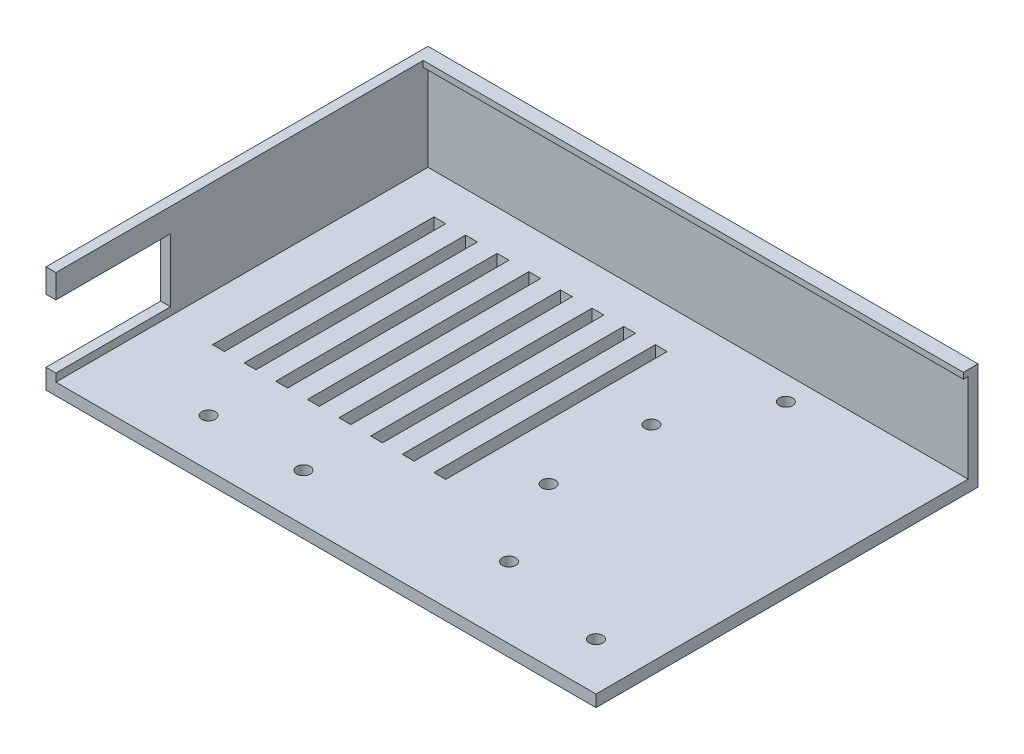
from build123d import *

# Parameters (mm, degrees)
SKETCH1_W                     = 278.2
SKETCH1_H                     = 193.2
SHELL_BLOCK_DEPTH             = 27
SKETCH2_W                     = 273.2
SKETCH2_H                     = 185.8
FRONT_OPENING_DEPTH           = 1.5
SKETCH3_W                     = 273.2
SKETCH3_H                     = 188.2
DISPLAY_POCKET_DEPTH          = 22.5
SKETCH4_W                     = 3
SKETCH4_H                     = 56
VENT_SLOTS_DEPTH              = 4
SKETCH5_W                     = 58
SKETCH5_H                     = 16
CABLE_EXIT_X_SHORT_SIDE_DEPTH = 140.1
SKETCH6_R                     = 1.7
BOLT_HOLES_DEPTH              = 4
KEEP_ONE_HALF_X_DEPTH         = 172.491603293
KEEP_ONE_HALF_X_DEPTH_BACK    = 172.491603293
SKETCH7_W                     = 200
SKETCH7_H                     = 400
KEEP_ONE_QUARTER_Z_DEPTH      = 172.491603293
KEEP_ONE_QUARTER_Z_DEPTH_BACK = 172.491603293
SKETCH8_W                     = 400
SKETCH8_H                     = 200


with BuildPart() as part:
    # Sketch1 → Shell Block (new body)
    with BuildSketch(Plane(origin=(0, 0, 0), x_dir=(1, 0, 0), z_dir=(0, 1, 0))):
        Rectangle(SKETCH1_W, SKETCH1_H)
    extrude(amount=SHELL_BLOCK_DEPTH)

    # Sketch2 → Front Opening (cut)
    with BuildSketch(Plane(origin=(0, 27, 0), x_dir=(1, 0, 0), z_dir=(0, 1, 0))):
        Rectangle(SKETCH2_W, SKETCH2_H)
    extrude(amount=-FRONT_OPENING_DEPTH, mode=Mode.SUBTRACT)

    # Sketch3 → Display Pocket (cut)
    with BuildSketch(Plane(origin=(0, 25.5, 0), x_dir=(1, 0, 0), z_dir=(0, 1, 0))):
        Rectangle(SKETCH3_W, SKETCH3_H)
    extrude(amount=-DISPLAY_POCKET_DEPTH, mode=Mode.SUBTRACT)

    # Sketch4 → Vent Slots (cut)
    with BuildSketch(Plane(origin=(0, 3, 0), x_dir=(1, 0, 0), z_dir=(0, 1, 0))):
        with Locations((-67.5, 56)):
            Rectangle(SKETCH4_W, SKETCH4_H)
        with Locations((-67.5, -56)):
            Rectangle(SKETCH4_W, SKETCH4_H)
        with Locations((-75.5, 56)):
            Rectangle(SKETCH4_W, SKETCH4_H)
        with Locations((-75.5, -56)):
            Rectangle(SKETCH4_W, SKETCH4_H)
        with Locations((-83.5, 56)):
            Rectangle(SKETCH4_W, SKETCH4_H)
        with Locations((-83.5, -56)):
            Rectangle(SKETCH4_W, SKETCH4_H)
        with Locations((-91.5, 56)):
            Rectangle(SKETCH4_W, SKETCH4_H)
        with Locations((-91.5, -56)):
            Rectangle(SKETCH4_W, SKETCH4_H)
        with Locations((-99.5, 56)):
            Rectangle(SKETCH4_W, SKETCH4_H)
        with Locations((-99.5, -56)):
            Rectangle(SKETCH4_W, SKETCH4_H)
        with Locations((-107.5, 56)):
            Rectangle(SKETCH4_W, SKETCH4_H)
        with Locations((-107.5, -56)):
            Rectangle(SKETCH4_W, SKETCH4_H)
        with Locations((-115.5, 56)):
            Rectangle(SKETCH4_W, SKETCH4_H)
        with Locations((-115.5, -56)):
            Rectangle(SKETCH4_W, SKETCH4_H)
        with Locations((-123.5, 56)):
            Rectangle(SKETCH4_W, SKETCH4_H)
        with Locations((-123.5, -56)):
            Rectangle(SKETCH4_W, SKETCH4_H)
    extrude(amount=-VENT_SLOTS_DEPTH, mode=Mode.SUBTRACT)

    # Sketch5 → Cable Exit (-X short side) (cut)
    with BuildSketch(Plane(origin=(0, 0, 0), x_dir=(0, 0, -1), z_dir=(1, 0, 0))):
        with Locations((0, 13)):
            Rectangle(SKETCH5_W, SKETCH5_H)
    extrude(amount=-CABLE_EXIT_X_SHORT_SIDE_DEPTH, mode=Mode.SUBTRACT)

    # Sketch6 → Bolt Holes (cut)
    with BuildSketch(Plane(origin=(0, 3, 0), x_dir=(1, 0, 0), z_dir=(0, 1, 0))):
        with Locations(Location((-40, 18, 0), (0, 0, 270))):
            Circle(SKETCH6_R)
        with Locations(Location((-40, 88, 0), (0, 0, 270))):
            Circle(SKETCH6_R)
        with Locations(Location((40, 18, 0), (0, 0, 270))):
            Circle(SKETCH6_R)
        with Locations(Location((40, 88, 0), (0, 0, 270))):
            Circle(SKETCH6_R)
        with Locations(Location((-52, 40, 0), (0, 0, 270))):
            Circle(SKETCH6_R)
        with Locations(Location((-52, 66, 0), (0, 0, 270))):
            Circle(SKETCH6_R)
        with Locations(Location((52, 40, 0), (0, 0, 270))):
            Circle(SKETCH6_R)
        with Locations(Location((52, 66, 0), (0, 0, 270))):
            Circle(SKETCH6_R)
        with Locations(Location((-12, -82, 0), (0, 0, 270))):
            Circle(SKETCH6_R)
        with Locations(Location((12, -82, 0), (0, 0, 270))):
            Circle(SKETCH6_R)
        with Locations(Location((124, -12, 0), (0, 0, 270))):
            Circle(SKETCH6_R)
        with Locations(Location((124, 12, 0), (0, 0, 270))):
            Circle(SKETCH6_R)
        with Locations(Location((-12, -12, 0), (0, 0, 270))):
            Circle(SKETCH6_R)
        with Locations(Location((-12, 12, 0), (0, 0, 270))):
            Circle(SKETCH6_R)
        with Locations(Location((12, -12, 0), (0, 0, 270))):
            Circle(SKETCH6_R)
        with Locations(Location((12, 12, 0), (0, 0, 270))):
            Circle(SKETCH6_R)
        with Locations(Location((-110, 12, 0), (0, 0, 270))):
            Circle(SKETCH6_R)
        with Locations(Location((-110, -12, 0), (0, 0, 270))):
            Circle(SKETCH6_R)
        with Locations(Location((-86, 12, 0), (0, 0, 270))):
            Circle(SKETCH6_R)
        with Locations(Location((-86, -12, 0), (0, 0, 270))):
            Circle(SKETCH6_R)
    extrude(amount=-BOLT_HOLES_DEPTH, mode=Mode.SUBTRACT)

    # Sketch7 → Keep one half (X) (cut, two sides: drawn at the far end of the back side and taken through both)
    with BuildSketch(Plane(origin=(0, 0, 0), x_dir=(1, 0, 0), z_dir=(0, 1, 0)).offset(-KEEP_ONE_HALF_X_DEPTH_BACK)):
        with Locations((100, 0)):
            Rectangle(SKETCH7_W, SKETCH7_H)
    extrude(amount=KEEP_ONE_HALF_X_DEPTH + KEEP_ONE_HALF_X_DEPTH_BACK, mode=Mode.SUBTRACT)

    # Sketch8 → Keep one quarter (Z) (cut, two sides: drawn at the far end of the back side and taken through both)
    with BuildSketch(Plane(origin=(0, 0, 0), x_dir=(1, 0, 0), z_dir=(0, 1, 0)).offset(-KEEP_ONE_QUARTER_Z_DEPTH_BACK)):
        with Locations((0, -100)):
            Rectangle(SKETCH8_W, SKETCH8_H)
    extrude(amount=KEEP_ONE_QUARTER_Z_DEPTH + KEEP_ONE_QUARTER_Z_DEPTH_BACK, mode=Mode.SUBTRACT)


solid = part.part
